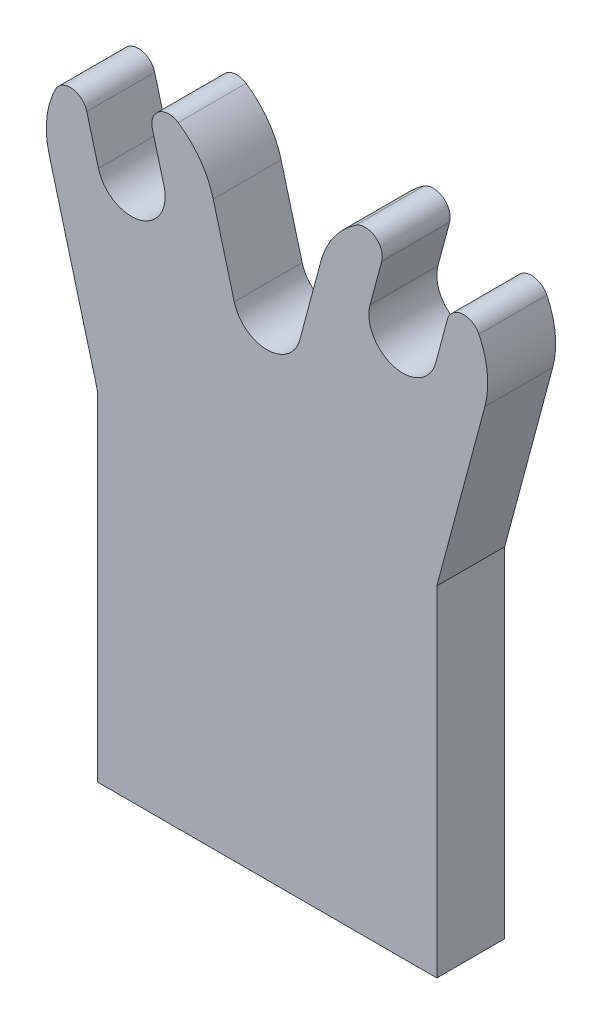
from build123d import *

# Parameters (mm, degrees)
BOSS_EXTRUDE1_DEPTH = 2
FILLET1_R           = 0.5
FILLET2_R           = 1


with BuildPart() as part:
    # Sketch1 → Boss-Extrude1 (new body)
    with BuildSketch(Plane.XY):
        with BuildLine():
            Line((-6.414814566, 10.280159843), (-5, 5))
            Line((-5, 5), (-5, -5))
            Line((-5, -5), (5, -5))
            Line((5, -5), (5, 5))
            Line((5, 5), (6.414814566, 10.280159843))
            ThreePointArc((6.414814566, 10.280159843), (6.374781392, 11.708496992), (5.558954759, 12.881602518))
            Line((5.558954759, 12.881602518), (4.965925826, 10.66838841))
            ThreePointArc((4.965925826, 10.66838841), (3.741180955, 9.961281629), (3.034074174, 11.1860265))
            Line((3.034074174, 11.1860265), (3.627103106, 13.399240608))
            ThreePointArc((3.627103106, 13.399240608), (2.334023755, 12.791214738), (1.585185434, 11.574255068))
            Line((1.585185434, 11.574255068), (0, 5.658262488))
            Line((0, 5.658262488), (-1.585185434, 11.574255068))
            ThreePointArc((-1.585185434, 11.574255068), (-2.334023755, 12.791214738), (-3.627103106, 13.399240608))
            Line((-3.627103106, 13.399240608), (-3.034074174, 11.1860265))
            ThreePointArc((-3.034074174, 11.1860265), (-3.741180955, 9.961281629), (-4.965925826, 10.66838841))
            Line((-4.965925826, 10.66838841), (-5.558954759, 12.881602518))
            ThreePointArc((-5.558954759, 12.881602518), (-6.374781392, 11.708496992), (-6.414814566, 10.280159843))
        make_face()
    extrude(amount=BOSS_EXTRUDE1_DEPTH)

    # Fillet1
    fillet1_edges = [part.edges().sort_by_distance(p)[0] for p in [
        (5.558954759, 12.881602518, 1),
        (-5.558954759, 12.881602518, 1),
        (-3.627103106, 13.399240608, 1),
        (3.627103106, 13.399240608, 1),
    ]]
    fillet(fillet1_edges, radius=FILLET1_R)

    # Fillet2
    fillet2_edges = [part.edges().sort_by_distance(p)[0] for p in [
        (0, 5.658262488, 1),
    ]]
    fillet(fillet2_edges, radius=FILLET2_R)


solid = part.part
